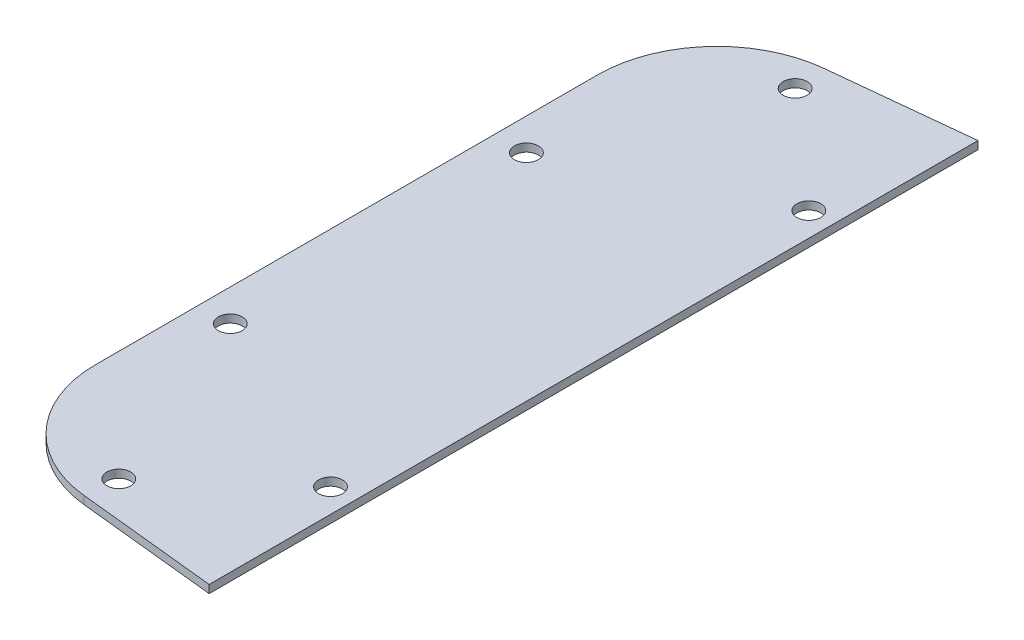
from build123d import *

# Parameters (mm, degrees)
EXTRUDE_1_DEPTH     = 1
CUT_EXTRUDE_1_REACH = 53.501
SKETCH_2_R          = 1.5
EXTRUDE_2_DEPTH     = 0.5


with BuildPart() as part:
    # 스케치1 → 보스-돌출1 (new body)
    with BuildSketch(Plane(origin=(0, 0, 0), x_dir=(1, 0, 0), z_dir=(0, 1, 0))):
        with BuildLine():
            Line((15.5, 47.342351167), (-2.051046792, 45.517737392))
            ThreePointArc((-2.051046792, 45.517737392), (-11.641492312, 40.641408305), (-15.5, 30.59814444))
            Line((-15.5, 30.59814444), (-15.5, -32.35898666))
            ThreePointArc((-15.5, -32.35898666), (-11.641492312, -42.402250525), (-2.051046792, -47.278579612))
            Line((-2.051046792, -47.278579612), (15.5, -49.103193387))
            Line((15.5, -49.103193387), (15.5, 47.342351167))
        make_face()
    extrude(amount=EXTRUDE_1_DEPTH)

    # 스케치2 → 컷-돌출1 (cut, up to next)
    with BuildSketch(Plane(origin=(0, 1, 0), x_dir=(1, 0, 0), z_dir=(0, 1, 0)), mode=Mode.PRIVATE) as cut_extrude_1_sk1:
        with Locations(Location((-1.637434314, 41.539179271, 0), (0, 0, 270))):
            Circle(SKETCH_2_R)
    cut_extrude_1_tool1 = extrude(cut_extrude_1_sk1.sketch, amount=-CUT_EXTRUDE_1_REACH, mode=Mode.PRIVATE) & part.part
    # 스케치2 → 컷-돌출1 (cut, up to next)
    with BuildSketch(Plane(origin=(0, 1, 0), x_dir=(1, 0, 0), z_dir=(0, 1, 0)), mode=Mode.PRIVATE) as cut_extrude_1_sk2:
        with Locations(Location((-11.5, 17.694952146, 0), (0, 0, 270))):
            Circle(SKETCH_2_R)
    cut_extrude_1_tool2 = extrude(cut_extrude_1_sk2.sketch, amount=-CUT_EXTRUDE_1_REACH, mode=Mode.PRIVATE) & part.part
    # 스케치2 → 컷-돌출1 (cut, up to next)
    with BuildSketch(Plane(origin=(0, 1, 0), x_dir=(1, 0, 0), z_dir=(0, 1, 0)), mode=Mode.PRIVATE) as cut_extrude_1_sk3:
        with Locations(Location((-11.5, -19.455794366, 0), (0, 0, 270))):
            Circle(SKETCH_2_R)
    cut_extrude_1_tool3 = extrude(cut_extrude_1_sk3.sketch, amount=-CUT_EXTRUDE_1_REACH, mode=Mode.PRIVATE) & part.part
    # 스케치2 → 컷-돌출1 (cut, up to next)
    with BuildSketch(Plane(origin=(0, 1, 0), x_dir=(1, 0, 0), z_dir=(0, 1, 0)), mode=Mode.PRIVATE) as cut_extrude_1_sk4:
        with Locations(Location((-1.637434314, -43.300021491, 0), (0, 0, 270))):
            Circle(SKETCH_2_R)
    cut_extrude_1_tool4 = extrude(cut_extrude_1_sk4.sketch, amount=-CUT_EXTRUDE_1_REACH, mode=Mode.PRIVATE) & part.part
    # 스케치2 → 컷-돌출1 (cut, up to next)
    with BuildSketch(Plane(origin=(0, 1, 0), x_dir=(1, 0, 0), z_dir=(0, 1, 0)), mode=Mode.PRIVATE) as cut_extrude_1_sk5:
        with Locations(Location((12.5, 29.11957889, 0), (0, 0, 270))):
            Circle(SKETCH_2_R)
    cut_extrude_1_tool5 = extrude(cut_extrude_1_sk5.sketch, amount=-CUT_EXTRUDE_1_REACH, mode=Mode.PRIVATE) & part.part
    # 스케치2 → 컷-돌출1 (cut, up to next)
    with BuildSketch(Plane(origin=(0, 1, 0), x_dir=(1, 0, 0), z_dir=(0, 1, 0)), mode=Mode.PRIVATE) as cut_extrude_1_sk6:
        with Locations(Location((12.5, -30.88042111, 0), (0, 0, 270))):
            Circle(SKETCH_2_R)
    cut_extrude_1_tool6 = extrude(cut_extrude_1_sk6.sketch, amount=-CUT_EXTRUDE_1_REACH, mode=Mode.PRIVATE) & part.part
    add(cut_extrude_1_tool1.solids().sort_by_distance((-1.637434, 1, -41.539179))[0], mode=Mode.SUBTRACT)
    add(cut_extrude_1_tool2.solids().sort_by_distance((-11.5, 1, -17.694952))[0], mode=Mode.SUBTRACT)
    add(cut_extrude_1_tool3.solids().sort_by_distance((-11.5, 1, 19.455794))[0], mode=Mode.SUBTRACT)
    add(cut_extrude_1_tool4.solids().sort_by_distance((-1.637434, 1, 43.300021))[0], mode=Mode.SUBTRACT)
    add(cut_extrude_1_tool5.solids().sort_by_distance((12.5, 1, -29.119579))[0], mode=Mode.SUBTRACT)
    add(cut_extrude_1_tool6.solids().sort_by_distance((12.5, 1, 30.880421))[0], mode=Mode.SUBTRACT)

    # 스케치3 → 보스-돌출2 (add)
    with BuildSketch(Plane.XZ):
        with BuildLine():
            Line((-11.3, -14.952234515), (-11.3, 16.713076735))
            ThreePointArc((-11.3, 16.713076735), (-8.75, 19.455794366), (-11.3, 22.198511996))
            Line((-11.3, 22.198511996), (-11.3, 32.35898666))
            ThreePointArc((-11.3, 32.35898666), (-9.367936379, 38.523376685), (-4.263017708, 42.482212318))
            ThreePointArc((-4.263017708, 42.482212318), (-1.182011658, 40.587994536), (1.111261685, 43.384699144))
            Line((1.111261685, 43.384699144), (9.3, 44.236003622))
            Line((9.3, 44.236003622), (9.3, -42.475161402))
            Line((9.3, -42.475161402), (1.111261685, -41.623856924))
            ThreePointArc((1.111261685, -41.623856924), (-1.182011658, -38.827152317), (-4.263017708, -40.721370098))
            ThreePointArc((-4.263017708, -40.721370098), (-9.367936379, -36.762534465), (-11.3, -30.59814444))
            Line((-11.3, -30.59814444), (-11.3, -20.437669776))
            ThreePointArc((-11.3, -20.437669776), (-8.75, -17.694952146), (-11.3, -14.952234515))
        make_face()
    extrude(amount=EXTRUDE_2_DEPTH)


solid = part.part
